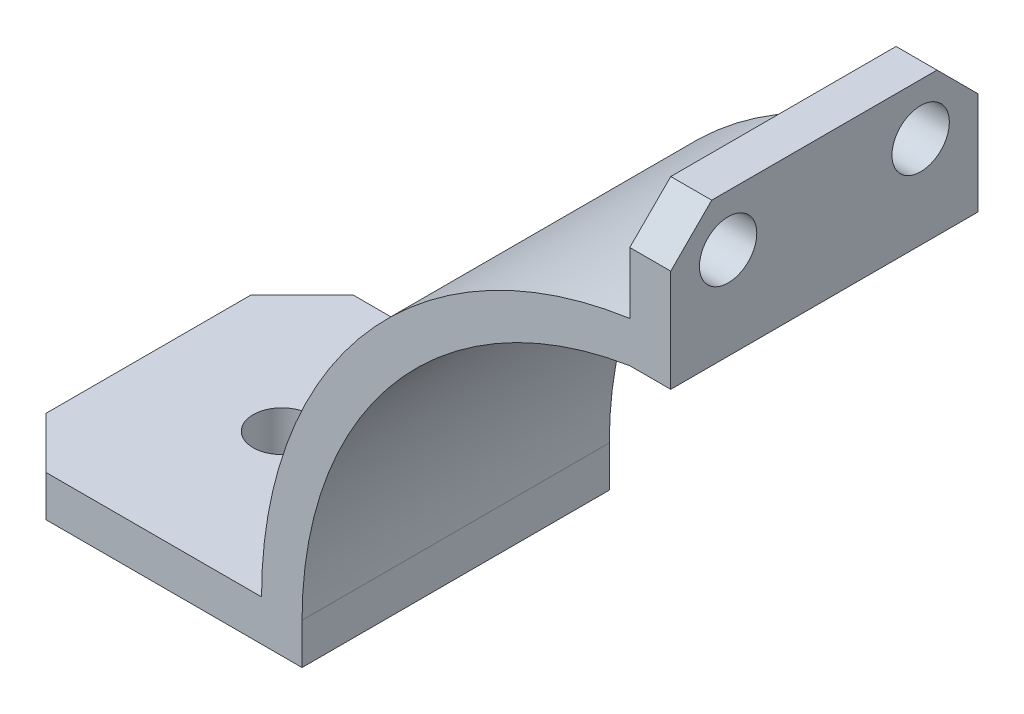
from build123d import *

# Parameters (mm, degrees)
BOSS_EXTRUDE1_DEPTH = 15
CHAMFER1_SIZE       = 2.5
SKETCH2_R           = 1.4
CUT_EXTRUDE1_DEPTH  = 15
CHAMFER2_SIZE       = 2
SKETCH3_R           = 1.4
CUT_EXTRUDE2_DEPTH  = 46.2179531


with BuildPart() as part:
    # Sketch1 → Boss-Extrude1 (new body)
    with BuildSketch(Plane.XY):
        with BuildLine():
            Line((-19, 0), (-19, -2))
            Line((-19, -2), (-34, -2))
            Line((-34, -2), (-34, 0))
            Line((-34, 0), (-20.977288961, 0))
            ThreePointArc((-20.977288961, 0), (-15.858412894, 13.731620175), (-3, 20.761663039))
            Line((-3, 20.761663039), (-3, 25.761663039))
            Line((-3, 25.761663039), (-1, 25.761663039))
            Line((-1, 25.761663039), (-1, 18.761663039))
            Line((-1, 18.761663039), (-3, 18.761663039))
            ThreePointArc((-3, 18.761663039), (-14.456832295, 12.328828006), (-19, 0))
        make_face()
    extrude(amount=BOSS_EXTRUDE1_DEPTH)

    # Chamfer1
    chamfer1_edges = [part.edges().sort_by_distance(p)[0] for p in [
        (-34, -1, 0),
        (-34, -1, 15),
    ]]
    chamfer(chamfer1_edges, length=CHAMFER1_SIZE)

    # Sketch2 → Cut-Extrude1 (cut)
    with BuildSketch(Plane.ZY.offset(3)):
        with Locations(Location((2.8, 23.261663039, 0), (0, 0, 270))):
            Circle(SKETCH2_R)
        with Locations(Location((12.2, 23.261663039, 0), (0, 0, 270))):
            Circle(SKETCH2_R)
    extrude(amount=-CUT_EXTRUDE1_DEPTH, mode=Mode.SUBTRACT)

    # Chamfer2
    chamfer2_edges = [part.edges().sort_by_distance(p)[0] for p in [
        (-2, 25.761663039, 0),
        (-2, 25.761663039, 15),
    ]]
    chamfer(chamfer2_edges, length=CHAMFER2_SIZE)

    # Sketch3 → Cut-Extrude2 (cut, through all)
    with BuildSketch(Plane(origin=(0, 0, 0), x_dir=(1, 0, 0), z_dir=(0, 1, 0))):
        with Locations(Location((-27.488644481, -7.5, 0), (0, 0, 270))):
            Circle(SKETCH3_R)
    extrude(amount=-CUT_EXTRUDE2_DEPTH, mode=Mode.SUBTRACT)


solid = part.part
